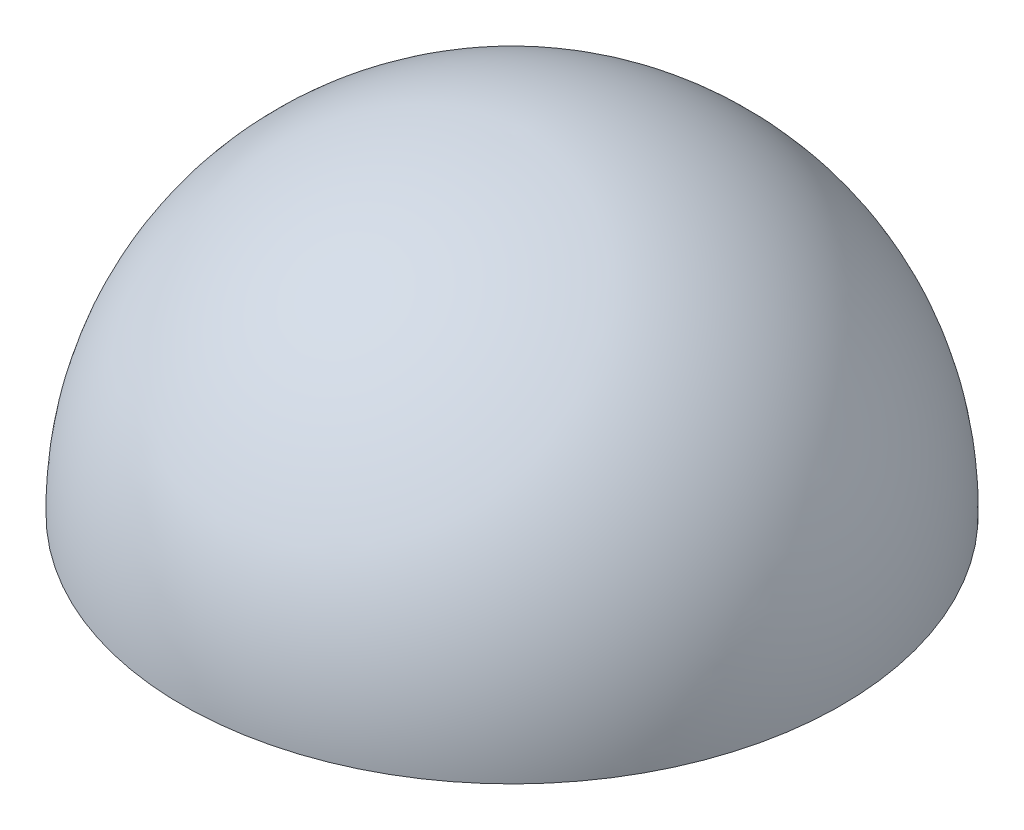
from build123d import *


with BuildPart() as part:
    # Sketch1 → Revolve1 (revolve)
    with BuildSketch(Plane.XY):
        with BuildLine():
            Line((0, 0), (0, 4))
            ThreePointArc((0, 4), (2.846069593, 2.846069593), (4, 0))
            Line((4, 0), (0, 0))
        make_face()
    revolve(axis=Axis((0, 0, 0), (0, 1, 0)))


solid = part.part
